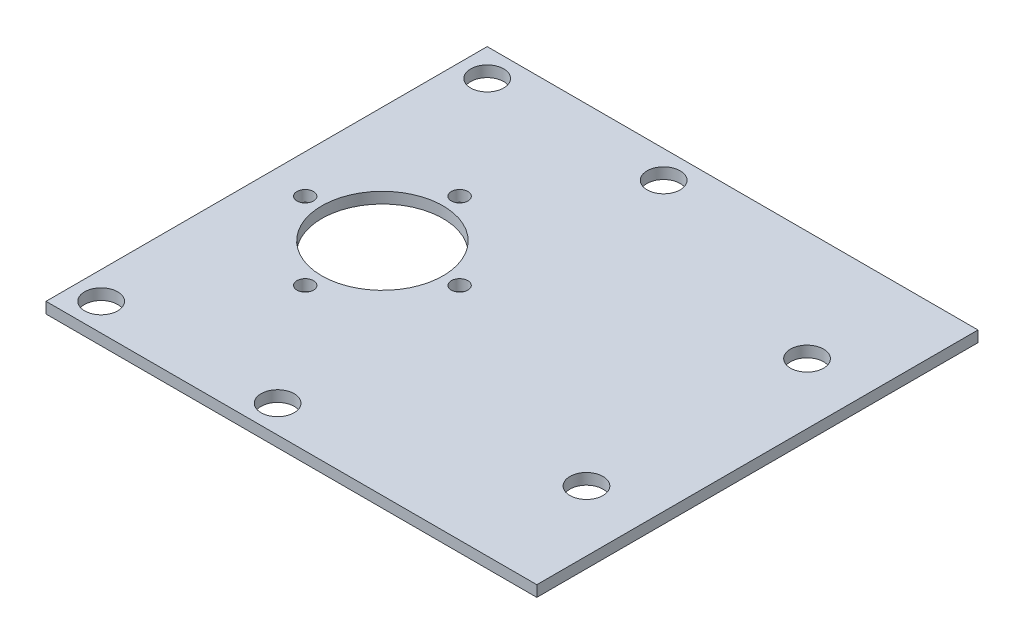
from build123d import *

# Parameters (mm, degrees)
ESQUISSE1_W      = 89
ESQUISSE1_H      = 80
EXTRUSION1_DEPTH = 2
ESQUISSE2_R      = 11
EXTRUSION3_DEPTH = 120.687092036
ESQUISSE4_R      = 1.5
ESQUISSE4_R_2    = 3
EXTRUSION4_DEPTH = 120.687092036


with BuildPart() as part:
    # Esquisse1 → Extrusion1 (new body)
    with BuildSketch(Plane(origin=(0, 0, 0), x_dir=(1, 0, 0), z_dir=(0, 1, 0))):
        with Locations((44.5, 40)):
            Rectangle(ESQUISSE1_W, ESQUISSE1_H)
    extrude(amount=EXTRUSION1_DEPTH)

    # Esquisse2 → Extrusion3 (cut, through all)
    with BuildSketch(Plane(origin=(0, 2, 0), x_dir=(1, 0, 0), z_dir=(0, 1, 0))):
        with Locations(Location((21, 40, 0), (0, 0, 270))):
            Circle(ESQUISSE2_R)
    extrude(amount=-EXTRUSION3_DEPTH, mode=Mode.SUBTRACT)

    # Esquisse4 → Extrusion4 (cut, through all)
    with BuildSketch(Plane(origin=(0, 2, 0), x_dir=(-1, 0, 0), z_dir=(0, 1, 0))):
        with Locations(Location((-35, -40, 0), (0, 0, 90))):
            Circle(ESQUISSE4_R)
        with Locations(Location((-21, -26, 0), (0, 0, 90))):
            Circle(ESQUISSE4_R)
        with Locations(Location((-7, -40, 0), (0, 0, 90))):
            Circle(ESQUISSE4_R)
        with Locations(Location((-21, -54, 0), (0, 0, 90))):
            Circle(ESQUISSE4_R)
        with Locations(Location((-5, -75, 0), (0, 0, 90))):
            Circle(ESQUISSE4_R_2)
        with Locations(Location((-5, -5, 0), (0, 0, 270))):
            Circle(ESQUISSE4_R_2)
        with Locations(Location((-37, -5, 0), (0, 0, 90))):
            Circle(ESQUISSE4_R_2)
        with Locations(Location((-37, -75, 0), (0, 0, 270))):
            Circle(ESQUISSE4_R_2)
        with Locations(Location((-78, -60, 0), (0, 0, 90))):
            Circle(ESQUISSE4_R_2)
        with Locations(Location((-78, -20, 0), (0, 0, 270))):
            Circle(ESQUISSE4_R_2)
    extrude(amount=-EXTRUSION4_DEPTH, mode=Mode.SUBTRACT)


solid = part.part
